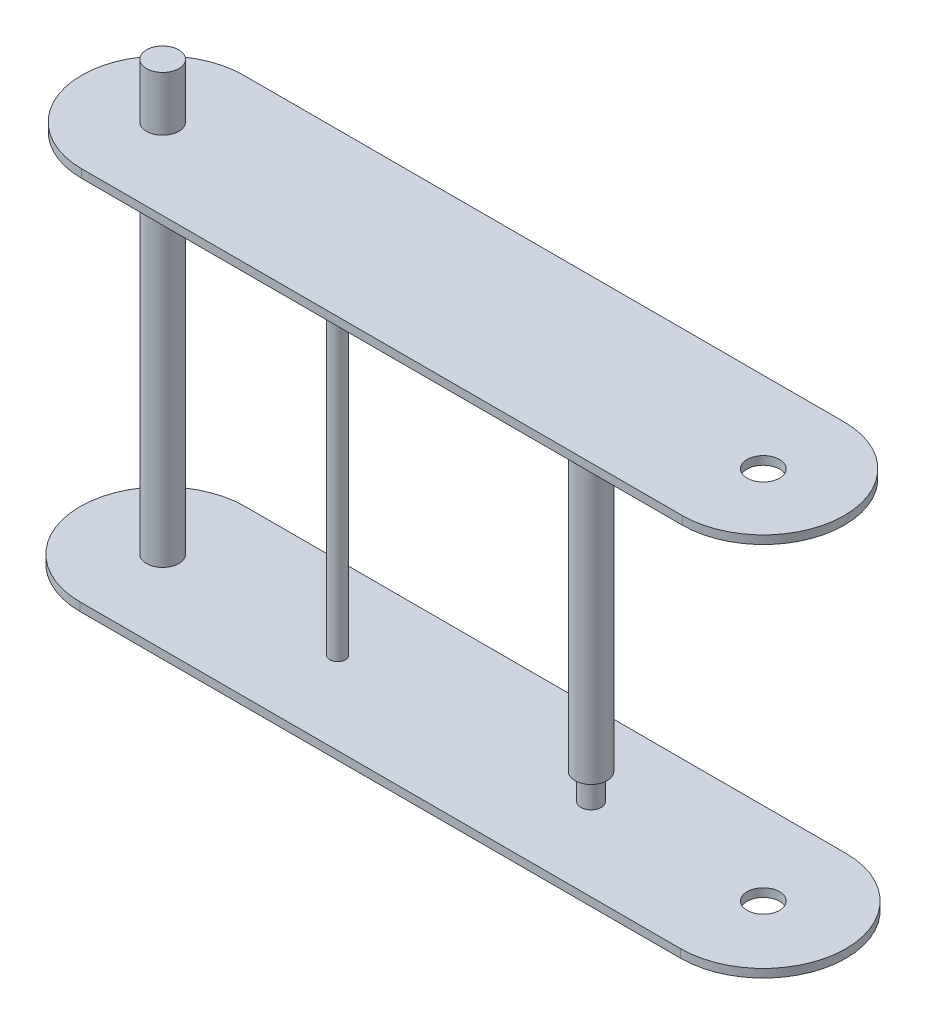
from build123d import *

# Parameters (mm, degrees)
SKETCH1_R            = 6.2
BOSS_EXTRUDE1_DEPTH  = 3.2
SKETCH8_R            = 6.15
BOSS_EXTRUDE5_DEPTH  = 140
SKETCH11_R           = 6.2
BOSS_EXTRUDE6_DEPTH  = 3.2
SKETCH12_R           = 3
BOSS_EXTRUDE7_DEPTH  = 140
SKETCH14_R           = 3.9
BOSS_EXTRUDE8_DEPTH  = 10
SKETCH15_R           = 6.15
BOSS_EXTRUDE9_DEPTH  = 60
SKETCH16_R           = 6.2
BOSS_EXTRUDE10_DEPTH = 94


with BuildPart() as part:
    # Sketch1 → Boss-Extrude1 (new body)
    with BuildSketch(Plane(origin=(0, 0, 0), x_dir=(1, 0, 0), z_dir=(0, 1, 0))):
        with BuildLine():
            Line((-110.589063221, 31.6), (119.210936779, 31.6))
            ThreePointArc((119.210936779, 31.6), (150.810936779, 0), (119.210936779, -31.6))
            Line((119.210936779, -31.6), (-110.589063221, -31.6))
            ThreePointArc((-110.589063221, -31.6), (-142.189063221, 0), (-110.589063221, 31.6))
        make_face()
        with Locations(Location((119.210936779, 0, 0), (0, 0, 270))):
            Circle(SKETCH1_R, mode=Mode.SUBTRACT)
    extrude(amount=BOSS_EXTRUDE1_DEPTH)

    # Sketch8 → Boss-Extrude5 (add)
    with BuildSketch(Plane(origin=(0, 3.2, 0), x_dir=(1, 0, 0), z_dir=(0, 1, 0))):
        with Locations(Location((-110.589063221, 0, 0), (0, 0, 270))):
            Circle(SKETCH8_R)
    extrude(amount=BOSS_EXTRUDE5_DEPTH)

    # Sketch11 → Boss-Extrude6 (add)
    with BuildSketch(Plane(origin=(0, 143.2, 0), x_dir=(1, 0, 0), z_dir=(0, 1, 0))):
        with BuildLine():
            Line((-110.589063221, 30.988193708), (119.210936779, 30.988193708))
            ThreePointArc((119.210936779, 30.988193708), (150.199130487, 0), (119.210936779, -30.988193708))
            Line((119.210936779, -30.988193708), (-110.589063221, -30.988193708))
            ThreePointArc((-110.589063221, -30.988193708), (-141.577256929, 0), (-110.589063221, 30.988193708))
        make_face()
        with Locations(Location((119.210936779, 0, 0), (0, 0, 270))):
            Circle(SKETCH11_R, mode=Mode.SUBTRACT)
    extrude(amount=BOSS_EXTRUDE6_DEPTH)

    # Sketch12 → Boss-Extrude7 (add)
    with BuildSketch(Plane(origin=(0, 3.2, 0), x_dir=(1, 0, 0), z_dir=(0, 1, 0))):
        with Locations(Location((-43.639063221, 0, 0), (0, 0, 270))):
            Circle(SKETCH12_R)
    extrude(amount=BOSS_EXTRUDE7_DEPTH)

    # Sketch14 → Boss-Extrude8 (add)
    with BuildSketch(Plane(origin=(0, 3.2, 0), x_dir=(1, 0, 0), z_dir=(0, 1, 0))):
        with Locations(Location((53.310936779, 0, 0), (0, 0, 270))):
            Circle(SKETCH14_R)
    boss_extrude8 = extrude(amount=BOSS_EXTRUDE8_DEPTH)

    # Sketch15 → Boss-Extrude9 (add)
    with BuildSketch(Plane(origin=(0, 13.2, 0), x_dir=(1, 0, 0), z_dir=(0, 1, 0))):
        with Locations(Location((53.310936779, 0, 0), (0, 0, 270))):
            Circle(SKETCH15_R)
    boss_extrude9 = extrude(amount=BOSS_EXTRUDE9_DEPTH)

    # Mirror7: Boss-Extrude8, Boss-Extrude9 across plane
    add(boss_extrude8.mirror(Plane.ZX.offset(73.2)))
    add(boss_extrude9.mirror(Plane.ZX.offset(73.2)))

    # Sketch16 → Boss-Extrude10 (add, symmetric)
    with BuildSketch(Plane(origin=(0, 73.2, 0), x_dir=(-1, 0, 0), z_dir=(0, -1, 0))):
        with Locations(Location((110.589063221, 0, 0), (0, 0, 270))):
            Circle(SKETCH16_R)
    extrude(amount=BOSS_EXTRUDE10_DEPTH, both=True)


solid = part.part
